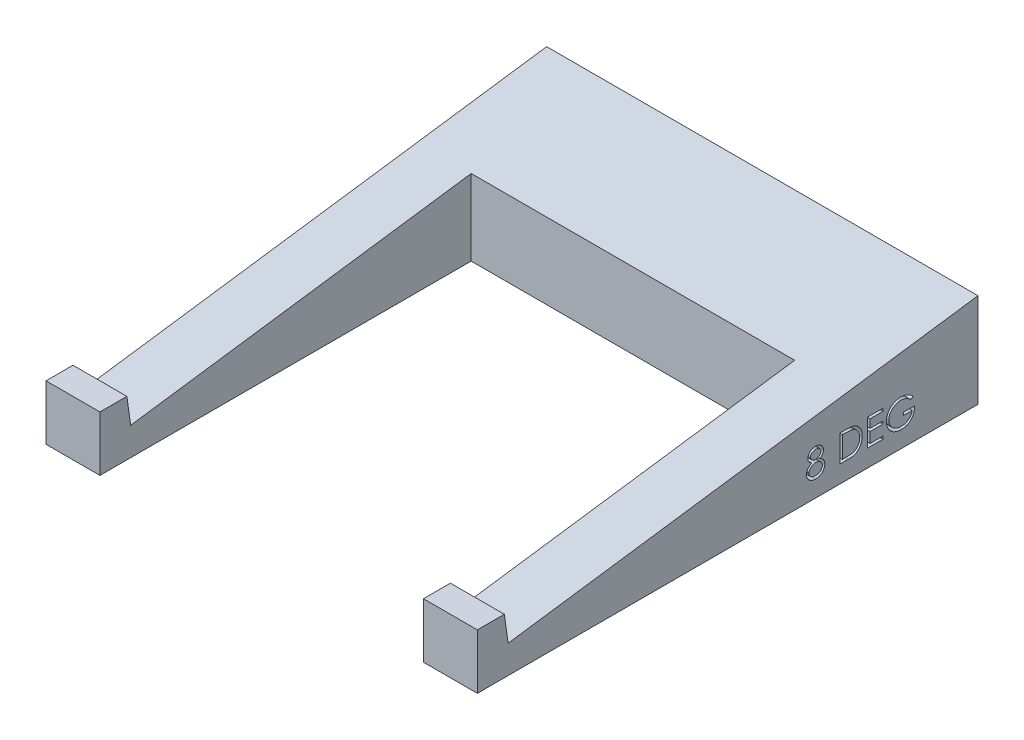
from build123d import *

# Parameters (mm, degrees)
BOSS_EXTRUDE1_DEPTH = 50.8
SKETCH5_W           = 38.1
SKETCH5_H           = 43.717396831
CUT_EXTRUDE2_DEPTH  = 75.204963684
CUT_EXTRUDE4_DEPTH  = 2.54


with BuildPart() as part:
    # Sketch1 → Boss-Extrude1 (new body)
    with BuildSketch(Plane(origin=(0, 0, 0), x_dir=(0, 0, -1), z_dir=(1, 0, 0))):
        Polygon((11.9888, 15.748), (11.9888, 26.826992882), (6.958238211, 26.119993529), (-43.347379681, 19.05), (-43.793596831, 22.225), (-46.968596831, 22.225), (-46.968596831, 15.748), align=None)
    extrude(amount=BOSS_EXTRUDE1_DEPTH)

    # Sketch5 → Cut-Extrude2 (cut, through all)
    with BuildSketch(Plane(origin=(0, 0, 0), x_dir=(1, 0, 0), z_dir=(0, 1, 0))):
        with Locations((25.4, -25.109898416)):
            Rectangle(SKETCH5_W, SKETCH5_H)
    extrude(amount=CUT_EXTRUDE2_DEPTH, mode=Mode.SUBTRACT)

    # Sketch7 → Cut-Extrude4 (cut)
    # profile 1 of 4: a face of its own
    with BuildSketch(Plane(origin=(50.8, 0, 0), x_dir=(0, 0, -1), z_dir=(1, 0, 0))):
        with BuildLine():
            add(Edge.make_bspline(
                [(-6.665469832, 19.548765024), (-6.639481507, 19.535214164), (-6.588795594, 19.508785461), (-6.516607698, 19.466230639), (-6.450635733, 19.421380621), (-6.389049294, 19.376353806), (-6.332930398, 19.329425808), (-6.282906537, 19.280410016), (-6.237742054, 19.230529908), (-6.198347757, 19.178940839), (-6.163697769, 19.125779865), (-6.133751046, 19.070907453), (-6.108154012, 19.014443857), (-6.087867632, 18.955772733), (-6.071156436, 18.895755924), (-6.059657851, 18.833618469), (-6.053473933, 18.769769817), (-6.052304795, 18.726618572), (-6.051712821, 18.704769631)],
                knots=[0, 0, 0, 0, 1.272397273, 2.481599622, 3.635517121, 4.734568067, 5.792894095, 6.808321871, 7.773003508, 8.711915296, 9.623354172, 10.525449501, 11.423591555, 12.311487226, 13.218079475, 14.126165749, 15.051214107, 16, 16, 16, 16], degree=3))
            add(Edge.make_bspline(
                [(-6.051712821, 18.704769631), (-6.052412609, 18.674200974), (-6.053797753, 18.613694131), (-6.065862739, 18.524389444), (-6.083926655, 18.437655899), (-6.110305927, 18.353512511), (-6.14451736, 18.272423579), (-6.18667849, 18.194319692), (-6.234404369, 18.117920747), (-6.272733186, 18.070913147), (-6.292127484, 18.047127404)],
                knots=[0, 0, 0, 0, 1.025265484, 2.029385089, 3.018602448, 3.995076438, 4.983346944, 5.966715145, 6.97116228, 8, 8, 8, 8], degree=3))
            add(Edge.make_bspline(
                [(-6.292127484, 18.047127404), (-6.317379143, 18.01937448), (-6.367570419, 17.964211583), (-6.453552074, 17.89259192), (-6.547914783, 17.832403541), (-6.650293414, 17.783352608), (-6.760414299, 17.745174722), (-6.878253974, 17.717740438), (-7.00404217, 17.70202652), (-7.090497847, 17.699755043), (-7.134850841, 17.698589744)],
                knots=[0, 0, 0, 0, 0.954267603, 1.896743057, 2.838368354, 3.796610408, 4.779680527, 5.799409237, 6.871065594, 8, 8, 8, 8], degree=3))
            add(Edge.make_bspline(
                [(-7.134850841, 17.698589744), (-7.177498701, 17.699635206), (-7.260487104, 17.701669569), (-7.381280322, 17.715453089), (-7.493877678, 17.739608368), (-7.598933863, 17.772668835), (-7.695815535, 17.815676685), (-7.784246634, 17.869205742), (-7.865503023, 17.931101407), (-7.937118753, 18.003141321), (-8.000698984, 18.080300962), (-8.056550004, 18.159904208), (-8.102972203, 18.241958325), (-8.142276068, 18.325239815), (-8.172364203, 18.41091597), (-8.19320328, 18.498545981), (-8.206437872, 18.58797679), (-8.208198758, 18.648330504), (-8.209084615, 18.678692909)],
                knots=[0, 0, 0, 0, 1.256902934, 2.445805442, 3.576955095, 4.645999104, 5.686449165, 6.692658513, 7.68621702, 8.689161843, 9.678783111, 10.630372946, 11.551080876, 12.453998257, 13.34127905, 14.221779781, 15.105423033, 16, 16, 16, 16], degree=3))
            add(Edge.make_bspline(
                [(-8.209084615, 18.678692909), (-8.208560395, 18.700971604), (-8.20752435, 18.74500217), (-8.200353523, 18.810052775), (-8.188825133, 18.87336784), (-8.17316834, 18.935181229), (-8.151949338, 18.995042927), (-8.126329688, 19.053236571), (-8.096455703, 19.10982786), (-8.061910646, 19.165126274), (-8.021722381, 19.218356974), (-7.976216785, 19.270423341), (-7.924484361, 19.320517463), (-7.867100628, 19.369251377), (-7.804721367, 19.417489582), (-7.735726321, 19.462625136), (-7.661944521, 19.507853432), (-7.60950676, 19.534893842), (-7.582607252, 19.548765024)],
                knots=[0, 0, 0, 0, 0.941657376, 1.861047343, 2.762797495, 3.66048619, 4.553285746, 5.444104102, 6.34607688, 7.256116206, 8.197091036, 9.162375105, 10.176350973, 11.237807142, 12.343728897, 13.50695164, 14.721116704, 16, 16, 16, 16], degree=3))
            add(Edge.make_bspline(
                [(-7.582607252, 19.548765024), (-7.619429427, 19.568844421), (-7.690727466, 19.607723755), (-7.785133316, 19.679158357), (-7.866223381, 19.756526589), (-7.931768732, 19.841462189), (-7.983359968, 19.931311853), (-8.018755416, 20.025513425), (-8.042700798, 20.122320185), (-8.04507282, 20.188456521), (-8.046264103, 20.221671675)],
                knots=[0, 0, 0, 0, 1.166880483, 2.259407225, 3.286803203, 4.280235371, 5.237608625, 6.161067461, 7.076446754, 8, 8, 8, 8], degree=3))
            add(Edge.make_bspline(
                [(-8.046264103, 20.221671675), (-8.044780539, 20.255505888), (-8.041798318, 20.323518558), (-8.017683449, 20.424761256), (-7.97838596, 20.52419914), (-7.924936198, 20.621350251), (-7.85836351, 20.712926517), (-7.778492714, 20.79506009), (-7.687231152, 20.867006935), (-7.585034373, 20.927401034), (-7.475055788, 20.976553353), (-7.359017952, 21.010460922), (-7.238942634, 21.032627971), (-7.157211131, 21.035137722), (-7.115770312, 21.036410256)],
                knots=[0, 0, 0, 0, 0.888701115, 1.786444228, 2.72001202, 3.692817113, 4.693886446, 5.687152267, 6.695133018, 7.739871481, 8.800368666, 9.853104506, 10.91144658, 12, 12, 12, 12], degree=3))
            add(Edge.make_bspline(
                [(-7.115770312, 21.036410256), (-7.075398995, 21.035098217), (-6.995791355, 21.032511024), (-6.8787748, 21.010932927), (-6.766810804, 20.974892577), (-6.660285473, 20.926000096), (-6.56110585, 20.865777657), (-6.473473755, 20.792842578), (-6.396064913, 20.711071314), (-6.332034784, 20.619522817), (-6.279272734, 20.522745013), (-6.242532631, 20.42148744), (-6.218990483, 20.317937937), (-6.216021074, 20.247872033), (-6.214533333, 20.212767428)],
                knots=[0, 0, 0, 0, 1.072916533, 2.115669174, 3.151510826, 4.193348718, 5.225979165, 6.227137561, 7.216255879, 8.211077061, 9.189680878, 10.138522389, 11.067357538, 12, 12, 12, 12], degree=3))
            add(Edge.make_bspline(
                [(-6.214533333, 20.212767428), (-6.215834685, 20.178317169), (-6.218390465, 20.110658817), (-6.239889696, 20.012028331), (-6.276096773, 19.919661195), (-6.325530764, 19.832509303), (-6.389961028, 19.75215323), (-6.468527521, 19.677571147), (-6.560603862, 19.608150381), (-6.62978338, 19.568974179), (-6.665469832, 19.548765024)],
                knots=[0, 0, 0, 0, 0.975232327, 1.915300861, 2.843280834, 3.77672583, 4.742871857, 5.749627742, 6.839139064, 8, 8, 8, 8], degree=3))
        make_face()
        with BuildLine():
            add(Edge.make_bspline(
                [(-7.131670753, 20.710769231), (-7.153941841, 20.710178281), (-7.197513828, 20.709022125), (-7.261402694, 20.70298179), (-7.322156199, 20.691231372), (-7.380409103, 20.675593398), (-7.43536274, 20.654467866), (-7.487763443, 20.629616679), (-7.536719394, 20.59940332), (-7.582821576, 20.565511376), (-7.624324064, 20.52823424), (-7.661158193, 20.48939608), (-7.691754411, 20.448234118), (-7.717735989, 20.405772248), (-7.736587794, 20.360750226), (-7.750706841, 20.314548373), (-7.760251246, 20.266582846), (-7.760966429, 20.233801868), (-7.761328205, 20.217219551)],
                knots=[0, 0, 0, 0, 1.203892937, 2.355340988, 3.463153438, 4.544400666, 5.610487187, 6.640501085, 7.674077295, 8.714426146, 9.728707835, 10.68524104, 11.601827946, 12.495867327, 13.368432065, 14.231010473, 15.105153427, 16, 16, 16, 16], degree=3))
            add(Edge.make_bspline(
                [(-7.761328205, 20.217219551), (-7.760704665, 20.200636518), (-7.759472461, 20.167866061), (-7.749942809, 20.11947374), (-7.735739805, 20.071919826), (-7.713378133, 20.026335071), (-7.686557223, 19.981138167), (-7.653454241, 19.937458707), (-7.61400348, 19.895144679), (-7.569528587, 19.854555986), (-7.521076692, 19.816547822), (-7.469746882, 19.78355215), (-7.41618337, 19.755944064), (-7.360936492, 19.732966676), (-7.303443187, 19.71510509), (-7.244055743, 19.702433532), (-7.18276418, 19.694557721), (-7.141234653, 19.693616994), (-7.120222436, 19.693141026)],
                knots=[0, 0, 0, 0, 0.873023192, 1.725219244, 2.590779336, 3.480155217, 4.391973325, 5.357036234, 6.360879153, 7.436073238, 8.526419356, 9.601555421, 10.645666583, 11.697338044, 12.750135903, 13.812665442, 14.89329948, 16, 16, 16, 16], degree=3))
            add(Edge.make_bspline(
                [(-7.120222436, 19.693141026), (-7.093234842, 19.693932841), (-7.039526208, 19.695508651), (-6.960351386, 19.710160072), (-6.883368844, 19.733206869), (-6.80940141, 19.764739124), (-6.740363679, 19.804315826), (-6.678823045, 19.851698635), (-6.625304435, 19.905793466), (-6.580364025, 19.965758181), (-6.545520807, 20.029577122), (-6.518395596, 20.093621673), (-6.502555779, 20.158575126), (-6.5004897, 20.202088014), (-6.499469231, 20.223579728)],
                knots=[0, 0, 0, 0, 1.076279235, 2.141928126, 3.20205304, 4.278698113, 5.344010996, 6.36967002, 7.368914609, 8.37248503, 9.349703398, 10.264243087, 11.142681841, 12, 12, 12, 12], degree=3))
            add(Edge.make_bspline(
                [(-6.499469231, 20.223579728), (-6.499951738, 20.238663732), (-6.500909445, 20.268603317), (-6.508801639, 20.312815977), (-6.521842573, 20.356022814), (-6.539498367, 20.39858076), (-6.56273011, 20.439892709), (-6.590274765, 20.480608082), (-6.623734277, 20.519810953), (-6.661286756, 20.558414915), (-6.703872948, 20.594141851), (-6.751410783, 20.625560481), (-6.803656542, 20.65224169), (-6.860611461, 20.673912204), (-6.922065785, 20.690188478), (-6.987736464, 20.702377165), (-7.05817107, 20.709247059), (-7.106639487, 20.710250835), (-7.131670753, 20.710769231)],
                knots=[0, 0, 0, 0, 0.814439003, 1.616544685, 2.417341072, 3.248991801, 4.09997495, 4.973547432, 5.9003056, 6.880240646, 7.880314356, 8.896779544, 9.951930927, 11.043077905, 12.18215768, 13.381699519, 14.647792085, 16, 16, 16, 16], degree=3))
        make_face(mode=Mode.SUBTRACT)
        with BuildLine():
            add(Edge.make_bspline(
                [(-7.113226242, 19.3675), (-7.141461776, 19.366997768), (-7.196853004, 19.366012512), (-7.278003218, 19.355045608), (-7.355884303, 19.339778944), (-7.430233674, 19.316618826), (-7.501019934, 19.286504867), (-7.568626281, 19.250278535), (-7.63253552, 19.207456454), (-7.691865136, 19.158582667), (-7.746042728, 19.105914448), (-7.793575472, 19.050159511), (-7.83394108, 18.992354071), (-7.866446957, 18.931763977), (-7.8931276, 18.869672216), (-7.910648046, 18.804532469), (-7.921880027, 18.737597016), (-7.923388271, 18.692094641), (-7.924148718, 18.669152644)],
                knots=[0, 0, 0, 0, 1.140299081, 2.23698856, 3.303958914, 4.344563908, 5.37730929, 6.408454204, 7.439741482, 8.480804886, 9.510774543, 10.48932336, 11.43758569, 12.353841022, 13.263987381, 14.161954604, 15.073269652, 16, 16, 16, 16], degree=3))
            add(Edge.make_bspline(
                [(-7.924148718, 18.669152644), (-7.922912047, 18.640640322), (-7.920458522, 18.584072542), (-7.900994286, 18.50046747), (-7.869756335, 18.419531227), (-7.826190604, 18.341923384), (-7.77224502, 18.269397217), (-7.705908867, 18.206179542), (-7.631304679, 18.150007915), (-7.545908197, 18.104577716), (-7.452628088, 18.068296669), (-7.351489163, 18.043299475), (-7.243942915, 18.026751874), (-7.169684571, 18.025084381), (-7.131670753, 18.024230769)],
                knots=[0, 0, 0, 0, 0.898778495, 1.783155532, 2.693654817, 3.627872908, 4.583023416, 5.533784346, 6.509005473, 7.520592997, 8.575161974, 9.658835044, 10.801527049, 12, 12, 12, 12], degree=3))
            add(Edge.make_bspline(
                [(-7.131670753, 18.024230769), (-7.101961491, 18.024801188), (-7.044078321, 18.025912548), (-6.959636067, 18.035722657), (-6.879948512, 18.051279817), (-6.805170188, 18.073907176), (-6.734463991, 18.101529655), (-6.669028734, 18.137064329), (-6.60718107, 18.177479651), (-6.551968616, 18.22542955), (-6.501682776, 18.27666452), (-6.457837575, 18.330902631), (-6.419776082, 18.386669811), (-6.389903001, 18.445226322), (-6.366021328, 18.505448738), (-6.348854961, 18.56789238), (-6.338262965, 18.63274877), (-6.337191724, 18.676744356), (-6.336648718, 18.699045473)],
                knots=[0, 0, 0, 0, 1.224942928, 2.386581632, 3.501229538, 4.569074225, 5.605009692, 6.626002462, 7.634866581, 8.645888296, 9.63523824, 10.59253846, 11.518950513, 12.414518923, 13.29783783, 14.186679152, 15.080837789, 16, 16, 16, 16], degree=3))
            add(Edge.make_bspline(
                [(-6.336648718, 18.699045473), (-6.337470452, 18.720705632), (-6.339090768, 18.763415682), (-6.349374767, 18.826703888), (-6.367441312, 18.887847869), (-6.392231165, 18.947583232), (-6.425233896, 19.004699623), (-6.464100313, 19.060685007), (-6.510994264, 19.113985496), (-6.563982833, 19.16501509), (-6.621730605, 19.212200794), (-6.683114372, 19.253942463), (-6.747661634, 19.289096169), (-6.815235804, 19.317686133), (-6.885686837, 19.340171909), (-6.958962914, 19.35587999), (-7.035149828, 19.365767487), (-7.086906747, 19.366915971), (-7.113226242, 19.3675)],
                knots=[0, 0, 0, 0, 0.917430815, 1.809013306, 2.70690318, 3.612392954, 4.541220862, 5.495268465, 6.494511384, 7.542276156, 8.608045339, 9.649016899, 10.681629292, 11.715607085, 12.752076957, 13.808767841, 14.885711793, 16, 16, 16, 16], degree=3))
        make_face(mode=Mode.SUBTRACT)
    # profile 2 of 4: a face of its own
    with BuildSketch(Plane(origin=(50.8, 0, 0), x_dir=(0, 0, -1), z_dir=(1, 0, 0))):
        with BuildLine():
            Line((-4.260687179, 17.78), (-4.260687179, 20.955))
            Line((-4.260687179, 20.955), (-3.61958141, 20.955))
            add(Edge.make_bspline(
                [(-3.61958141, 20.955), (-3.563820257, 20.954598526), (-3.456089998, 20.95382288), (-3.300412992, 20.948904903), (-3.156373436, 20.940204981), (-3.024445057, 20.927532625), (-2.904265672, 20.911972373), (-2.796171792, 20.892468435), (-2.699604491, 20.869437737), (-2.640214355, 20.849802222), (-2.612129487, 20.840516827)],
                knots=[0, 0, 0, 0, 1.314313732, 2.53924729, 3.670748893, 4.714932338, 5.66265055, 6.526160246, 7.303039223, 8, 8, 8, 8], degree=3))
            add(Edge.make_bspline(
                [(-2.612129487, 20.840516827), (-2.575394974, 20.826518973), (-2.502758964, 20.798840689), (-2.399338217, 20.746628901), (-2.30197878, 20.687471302), (-2.210158556, 20.621289912), (-2.125974949, 20.546210824), (-2.046139214, 20.465423325), (-1.973917286, 20.375989617), (-1.907779046, 20.279764449), (-1.848147412, 20.177881373), (-1.796314033, 20.070534524), (-1.753266482, 19.958269057), (-1.717531198, 19.841397173), (-1.689367626, 19.719661887), (-1.670152588, 19.592921452), (-1.657478904, 19.461676758), (-1.656205229, 19.372618495), (-1.655558974, 19.327430889)],
                knots=[0, 0, 0, 0, 0.984719456, 1.947108742, 2.898477687, 3.838006223, 4.779231079, 5.722358779, 6.681677486, 7.655904652, 8.64651281, 9.637519902, 10.640069247, 11.656948941, 12.698408672, 13.768548281, 14.867775369, 16, 16, 16, 16], degree=3))
            add(Edge.make_bspline(
                [(-1.655558974, 19.327430889), (-1.656129538, 19.288186766), (-1.657253892, 19.210852122), (-1.667349772, 19.096877881), (-1.682024005, 18.986284855), (-1.70474267, 18.879599684), (-1.732322093, 18.775887658), (-1.767668145, 18.676254122), (-1.808158916, 18.579785095), (-1.855375592, 18.487784956), (-1.907210991, 18.400623612), (-1.962838572, 18.318458668), (-2.022199003, 18.242462574), (-2.085858327, 18.17240519), (-2.152993899, 18.10839213), (-2.224045256, 18.049888659), (-2.299195737, 17.998039498), (-2.37810875, 17.950807193), (-2.463086382, 17.909604442), (-2.555738203, 17.874742933), (-2.656459343, 17.845853503), (-2.765002575, 17.821749905), (-2.881555445, 17.802629781), (-3.006232221, 17.789815125), (-3.138841348, 17.78114925), (-3.229899681, 17.780390522), (-3.276767909, 17.78)],
                knots=[0, 0, 0, 0, 1.105936401, 2.179363191, 3.223086493, 4.248585256, 5.251745608, 6.245858792, 7.225916811, 8.198733463, 9.158002045, 10.082870192, 10.993790845, 11.873723703, 12.748670949, 13.606408763, 14.465103618, 15.319838547, 16.196477973, 17.123216899, 18.106603292, 19.147568657, 20.255746949, 21.433717677, 22.679120308, 24, 24, 24, 24], degree=3))
            Line((-3.276767909, 17.78), (-4.260687179, 17.78))
        make_face()
        with BuildLine():
            Line((-3.975751282, 18.105641026), (-3.611313181, 18.105641026))
            add(Edge.make_bspline(
                [(-3.611313181, 18.105641026), (-3.558945302, 18.105866084), (-3.458222692, 18.106298955), (-3.31339008, 18.110097347), (-3.181056628, 18.116303961), (-3.061203544, 18.124989925), (-2.953898501, 18.136482168), (-2.858917242, 18.149295473), (-2.776571115, 18.165258875), (-2.726742268, 18.179728674), (-2.703716026, 18.186415264)],
                knots=[0, 0, 0, 0, 1.375205317, 2.645023457, 3.804390687, 4.853969522, 5.800190428, 6.637939096, 7.370582563, 8, 8, 8, 8], degree=3))
            add(Edge.make_bspline(
                [(-2.703716026, 18.186415264), (-2.674734297, 18.196622035), (-2.617463068, 18.216791788), (-2.535020941, 18.253583381), (-2.45813423, 18.297164401), (-2.385462992, 18.345607892), (-2.318038098, 18.40062248), (-2.255060507, 18.461011877), (-2.196657015, 18.527083423), (-2.143431036, 18.598755112), (-2.095798503, 18.675580856), (-2.054549602, 18.756805369), (-2.01839857, 18.84153869), (-1.990024418, 18.931081998), (-1.967785281, 19.024634787), (-1.952033028, 19.122203637), (-1.942222528, 19.223770329), (-1.941078215, 19.292851184), (-1.940494872, 19.328066907)],
                knots=[0, 0, 0, 0, 0.998632004, 1.973411704, 2.929992603, 3.868527914, 4.809262121, 5.754881198, 6.702106254, 7.672490631, 8.653608572, 9.636854334, 10.631411391, 11.644891563, 12.686317036, 13.754757253, 14.855430412, 16, 16, 16, 16], degree=3))
            add(Edge.make_bspline(
                [(-1.940494872, 19.328066907), (-1.940960497, 19.365199421), (-1.941875221, 19.438146574), (-1.953372631, 19.545180991), (-1.970174328, 19.648124152), (-1.994470958, 19.746982944), (-2.025432541, 19.841950235), (-2.064071966, 19.93250079), (-2.108219542, 20.019590921), (-2.16074614, 20.101210525), (-2.218273143, 20.178402131), (-2.282115933, 20.249118376), (-2.351260211, 20.313520348), (-2.424951824, 20.37261101), (-2.505267622, 20.424013059), (-2.590315612, 20.46999312), (-2.681343471, 20.509014678), (-2.74467356, 20.529769075), (-2.776858053, 20.540316506)],
                knots=[0, 0, 0, 0, 1.122418816, 2.205001699, 3.251619955, 4.274784885, 5.280384055, 6.268708349, 7.249350384, 8.229342522, 9.199999885, 10.157847722, 11.105861043, 12.055065948, 13.010012805, 13.98527497, 14.976112212, 16, 16, 16, 16], degree=3))
            add(Edge.make_bspline(
                [(-2.776858053, 20.540316506), (-2.803483736, 20.547679266), (-2.860097243, 20.563334513), (-2.952480185, 20.580411815), (-3.056452499, 20.595474468), (-3.172475799, 20.608227118), (-3.30041783, 20.617377759), (-3.44037699, 20.624246023), (-3.592413774, 20.628878468), (-3.69780793, 20.629194796), (-3.752509095, 20.629358974)],
                knots=[0, 0, 0, 0, 0.674548936, 1.434276114, 2.292660221, 3.240891867, 4.284742987, 5.42552168, 6.663806718, 8, 8, 8, 8], degree=3))
            Line((-3.752509095, 20.629358974), (-3.975751282, 20.629358974))
            Line((-3.975751282, 20.629358974), (-3.975751282, 18.105641026))
        make_face(mode=Mode.SUBTRACT)
    # profile 3 of 4: a face of its own
    with BuildSketch(Plane(origin=(50.8, 0, 0), x_dir=(0, 0, -1), z_dir=(1, 0, 0))):
        Polygon((-1.004276923, 20.955), (0.786748718, 20.955), (0.786748718, 20.629358974), (-0.719341026, 20.629358974), (-0.719341026, 19.652435897), (0.786748718, 19.652435897), (0.786748718, 19.326794872), (-0.719341026, 19.326794872), (-0.719341026, 18.105641026), (0.786748718, 18.105641026), (0.786748718, 17.78), (-1.004276923, 17.78), align=None)
    # profile 4 of 4: a face of its own
    with BuildSketch(Plane(origin=(50.8, 0, 0), x_dir=(0, 0, -1), z_dir=(1, 0, 0))):
        with BuildLine():
            Line((4.328094872, 20.413112981), (4.083864103, 20.181602564))
            add(Edge.make_bspline(
                [(4.083864103, 20.181602564), (4.039669111, 20.223177704), (3.952332983, 20.305336601), (3.80994762, 20.411935861), (3.661390609, 20.503254395), (3.50743713, 20.577555052), (3.351899728, 20.636839342), (3.196842909, 20.679047012), (3.043857166, 20.705964242), (2.942105475, 20.70918312), (2.891967067, 20.710769231)],
                knots=[0, 0, 0, 0, 1.08915593, 2.152340314, 3.188132944, 4.216796309, 5.218260357, 6.173443236, 7.099959455, 8, 8, 8, 8], degree=3))
            add(Edge.make_bspline(
                [(2.891967067, 20.710769231), (2.86120159, 20.710394031), (2.799750426, 20.709644605), (2.708471948, 20.700079495), (2.618150784, 20.686322797), (2.528957437, 20.66641838), (2.440718484, 20.64119159), (2.353740818, 20.609636205), (2.267862189, 20.572846805), (2.18389153, 20.530335847), (2.102484073, 20.483636272), (2.025597515, 20.431885096), (1.952741789, 20.376740979), (1.88528626, 20.316823305), (1.822842912, 20.25267482), (1.76392546, 20.185488821), (1.710606056, 20.11342973), (1.662444785, 20.037823341), (1.619481031, 19.959997569), (1.58155461, 19.8807015), (1.549716537, 19.800198146), (1.524525674, 19.71838649), (1.503742438, 19.635899455), (1.489121466, 19.552165887), (1.480878511, 19.467096129), (1.479452682, 19.410130045), (1.478735897, 19.381492388)],
                knots=[0, 0, 0, 0, 1.02818874, 2.053710826, 3.065248034, 4.081641283, 5.106893873, 6.131558223, 7.173050175, 8.228653731, 9.27666206, 10.308777013, 11.325269123, 12.329503258, 13.32196095, 14.316845687, 15.314881793, 16.315733098, 17.311955233, 18.285320748, 19.252783886, 20.203351036, 21.145449891, 22.095197417, 23.042428769, 24, 24, 24, 24], degree=3))
            add(Edge.make_bspline(
                [(1.478735897, 19.381492388), (1.479421442, 19.352218146), (1.480790659, 19.293749602), (1.489553949, 19.206487836), (1.505817424, 19.120522078), (1.52755956, 19.035569843), (1.554756443, 18.95148564), (1.58865879, 18.868634006), (1.628814013, 18.787018008), (1.675292885, 18.707373027), (1.726261798, 18.629791427), (1.783360165, 18.556712433), (1.844012265, 18.487162899), (1.910427732, 18.422687027), (1.980476888, 18.361560207), (2.056252595, 18.305466555), (2.136264827, 18.253325596), (2.220635655, 18.205794467), (2.308449608, 18.163332438), (2.398489662, 18.125573618), (2.491043467, 18.094477362), (2.585624621, 18.069133511), (2.682120374, 18.04835967), (2.781020538, 18.034995206), (2.881597924, 18.025297095), (2.94939654, 18.024588008), (2.983553606, 18.024230769)],
                knots=[0, 0, 0, 0, 0.93586088, 1.869166235, 2.799637598, 3.729985548, 4.670839027, 5.622275134, 6.589130586, 7.576015415, 8.568469353, 9.55398029, 10.53834874, 11.515998671, 12.510579167, 13.508179873, 14.527009472, 15.561807829, 16.601455013, 17.643573243, 18.680854198, 19.719860599, 20.772568776, 21.833555941, 22.908541556, 24, 24, 24, 24], degree=3))
            add(Edge.make_bspline(
                [(2.983553606, 18.024230769), (3.024718249, 18.025091263), (3.105551715, 18.026780984), (3.224375131, 18.039934818), (3.338496488, 18.060478695), (3.447595115, 18.090564901), (3.551797727, 18.128940378), (3.651486323, 18.175200478), (3.745876042, 18.231119539), (3.835250635, 18.294232975), (3.917580368, 18.364550002), (3.991833752, 18.440427472), (4.056826446, 18.521497075), (4.113527137, 18.607281326), (4.160434274, 18.698490281), (4.198935952, 18.794676963), (4.228448295, 18.895884634), (4.240563165, 18.965817757), (4.246684615, 19.001153846)],
                knots=[0, 0, 0, 0, 1.13008108, 2.219097802, 3.278683437, 4.311054135, 5.322181354, 6.324827112, 7.324222904, 8.330512327, 9.32562643, 10.293043162, 11.24128371, 12.174520618, 13.111833804, 14.052305215, 15.015860969, 16, 16, 16, 16], degree=3))
            Line((4.246684615, 19.001153846), (3.188351282, 19.001153846))
            Line((3.188351282, 19.001153846), (3.188351282, 19.326794872))
            Line((3.188351282, 19.326794872), (4.531620513, 19.326794872))
            add(Edge.make_bspline(
                [(4.531620513, 19.326794872), (4.530073065, 19.266100221), (4.527044429, 19.147309826), (4.505800127, 18.974072509), (4.471495148, 18.810449616), (4.424631865, 18.656268829), (4.363966432, 18.511748642), (4.290149924, 18.37674232), (4.202000929, 18.252122045), (4.102659314, 18.136870449), (3.991171495, 18.034064664), (3.870549961, 17.943707849), (3.740595426, 17.867596191), (3.601430815, 17.805674018), (3.453511707, 17.757346894), (3.29649582, 17.723082678), (3.130596082, 17.702554069), (3.016897811, 17.699931175), (2.958748918, 17.698589744)],
                knots=[0, 0, 0, 0, 1.140356446, 2.231883559, 3.274166699, 4.278491846, 5.25512956, 6.21435461, 7.1637429, 8.11826594, 9.068280886, 10.0076534, 10.945064095, 11.891975133, 12.864533718, 13.863980011, 14.907571808, 16, 16, 16, 16], degree=3))
            add(Edge.make_bspline(
                [(2.958748918, 17.698589744), (2.922907581, 17.699106018), (2.852216913, 17.700124277), (2.747813, 17.707360871), (2.64628773, 17.718501108), (2.547655893, 17.735324184), (2.451554683, 17.75592962), (2.358464059, 17.78231543), (2.268029407, 17.81285775), (2.180110949, 17.847597396), (2.095506682, 17.887848828), (2.01383977, 17.932579715), (1.934658784, 17.981559407), (1.858503085, 18.03563496), (1.784975871, 18.094401906), (1.714551247, 18.157978032), (1.646834958, 18.226168976), (1.604416537, 18.274591364), (1.583042788, 18.298990385)],
                knots=[0, 0, 0, 0, 1.107784379, 2.184907829, 3.233506516, 4.263428166, 5.276301166, 6.270063455, 7.25232949, 8.225834625, 9.190232166, 10.146266622, 11.1027726, 12.066435141, 13.031522626, 14.010570082, 14.99756817, 16, 16, 16, 16], degree=3))
            add(Edge.make_bspline(
                [(1.583042788, 18.298990385), (1.552031264, 18.337698763), (1.490522976, 18.414473), (1.41134922, 18.537481521), (1.343856518, 18.664846065), (1.28909428, 18.796921192), (1.246333301, 18.933583364), (1.215666201, 19.07465795), (1.19769816, 19.220326615), (1.195109594, 19.318901533), (1.1938, 19.368772035)],
                knots=[0, 0, 0, 0, 1.023165419, 2.029347347, 3.013907458, 3.994755782, 4.975994455, 5.96558838, 6.970761222, 8, 8, 8, 8], degree=3))
            add(Edge.make_bspline(
                [(1.1938, 19.368772035), (1.194282816, 19.406115707), (1.195242312, 19.480328436), (1.206876887, 19.590507565), (1.223569602, 19.698730336), (1.248105144, 19.804908283), (1.279035327, 19.90911232), (1.317637418, 20.01139083), (1.362581717, 20.111804171), (1.414819988, 20.20966118), (1.472953748, 20.303663326), (1.536045734, 20.39343219), (1.604991857, 20.477332985), (1.678666189, 20.556428266), (1.757947744, 20.629724363), (1.842093793, 20.697899877), (1.931169183, 20.76104626), (2.025454146, 20.818168896), (2.123541403, 20.86948018), (2.225195832, 20.914464679), (2.330386404, 20.951642401), (2.438325045, 20.983187187), (2.549828778, 21.006514493), (2.664088443, 21.023431569), (2.781699616, 21.035007256), (2.861198014, 21.035938217), (2.901507332, 21.036410256)],
                knots=[0, 0, 0, 0, 1.008945113, 2.00506715, 2.99143336, 3.967273523, 4.948097931, 5.927297278, 6.919902385, 7.919676788, 8.923139349, 9.905703106, 10.883022732, 11.856032218, 12.825136022, 13.798837087, 14.781400844, 15.773989409, 16.776158564, 17.77167057, 18.775803737, 19.789618931, 20.80898985, 21.851988756, 22.910860228, 24, 24, 24, 24], degree=3))
            add(Edge.make_bspline(
                [(2.901507332, 21.036410256), (2.934380596, 21.035884575), (2.999564415, 21.034842209), (3.096561329, 21.027617136), (3.192058993, 21.016165472), (3.286199003, 21.000538316), (3.378660778, 20.979253397), (3.469707718, 20.953782381), (3.559471805, 20.924126228), (3.647671717, 20.888757774), (3.734900502, 20.848613415), (3.821643171, 20.803425524), (3.907603344, 20.752421413), (3.992930092, 20.695449634), (4.078161477, 20.633488677), (4.161949403, 20.564766415), (4.246316359, 20.491992915), (4.300565148, 20.439666934), (4.328094872, 20.413112981)],
                knots=[0, 0, 0, 0, 0.985871117, 1.954866573, 2.915460327, 3.869826059, 4.81536089, 5.759505086, 6.70452669, 7.649098992, 8.607881297, 9.583363685, 10.581137262, 11.603961102, 12.659522466, 13.73993555, 14.853081303, 16, 16, 16, 16], degree=3))
        make_face()
    extrude(amount=-CUT_EXTRUDE4_DEPTH, mode=Mode.SUBTRACT)


solid = part.part
